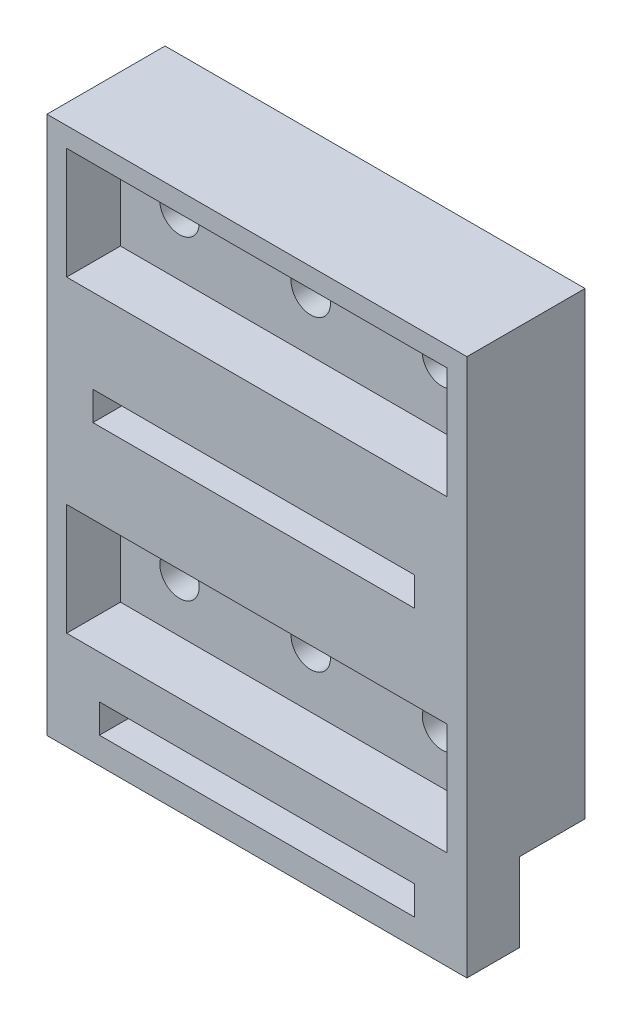
from build123d import *

# Parameters (mm, degrees)
SKETCH4_W                 = 32
SKETCH4_H                 = 35
BOSS_EXTRUDE1_DEPTH       = 9
SHELL1_T                  = -1.5
SHELL1_THICKNESS_2_FACE_W = 29
SHELL1_THICKNESS_2_FACE_H = 32
SHELL1_THICKNESS_2_DEPTH  = 3.4
SKETCH5_R                 = 1.5
CUT_EXTRUDE2_DEPTH        = 9
RIB6_REACH                = 27.362
SKETCH12_WALLS_W          = 81.724747412
SKETCH12_WALLS_H          = 15
SKETCH13_W                = 28
SKETCH13_H                = 10
CUT_EXTRUDE3_DEPTH        = 5
SKETCH15_W                = 24.5
SKETCH15_H                = 2.2
CUT_EXTRUDE4_DEPTH        = 10
SKETCH16_W                = 32
SKETCH16_H                = 4
BOSS_EXTRUDE2_DEPTH       = 6
SKETCH17_W                = 24
SKETCH17_H                = 2.2
CUT_EXTRUDE5_DEPTH        = 10


with BuildPart() as part:
    # Sketch4 → Boss-Extrude1 (new body)
    with BuildSketch(Plane.XY):
        Rectangle(SKETCH4_W, SKETCH4_H)
    extrude(amount=BOSS_EXTRUDE1_DEPTH)

    # Shell1
    shell1_openings = [part.faces().sort_by_distance(p)[0] for p in [
        (0, 0, 9),
    ]]
    offset(amount=SHELL1_T, openings=shell1_openings, kind=Kind.INTERSECTION)

    # Shell1 thickness 2 face (on inner face of the shell) → Shell1 thickness 2 (add)
    with BuildSketch(Plane(origin=(0, 0, 1.5), x_dir=(-1, 0, 0), z_dir=(0, 0, -1))):
        Rectangle(SHELL1_THICKNESS_2_FACE_W, SHELL1_THICKNESS_2_FACE_H)
    extrude(amount=-SHELL1_THICKNESS_2_DEPTH)

    # Sketch5 → Cut-Extrude2 (cut)
    with BuildSketch(Plane.XY.offset(4.9)):
        with Locations((-10, -12)):
            Circle(SKETCH5_R)
        with Locations((10, -12)):
            Circle(SKETCH5_R)
        with Locations((0, 11.7)):
            Circle(SKETCH5_R)
        with Locations((0, -11.7)):
            Circle(SKETCH5_R)
        with Locations((-10, 12)):
            Circle(SKETCH5_R)
        with Locations((10, 12)):
            Circle(SKETCH5_R)
    extrude(amount=-CUT_EXTRUDE2_DEPTH, mode=Mode.SUBTRACT)

    # Sketch12 walls → Rib6 (add, up to next)
    with BuildSketch(Plane.XY.offset(9), mode=Mode.PRIVATE) as rib6_sk1:
        Rectangle(SKETCH12_WALLS_W, SKETCH12_WALLS_H)
    rib6_tool1 = extrude(rib6_sk1.sketch, amount=-RIB6_REACH, mode=Mode.PRIVATE) - part.part
    add(rib6_tool1.solids().sort_by_distance((0, 0, 9))[0])

    # Sketch13 → Cut-Extrude3 (cut)
    with BuildSketch(Plane(origin=(0, 0, 0), x_dir=(-1, 0, 0), z_dir=(0, 0, -1))):
        Rectangle(SKETCH13_W, SKETCH13_H)
    extrude(amount=-CUT_EXTRUDE3_DEPTH, mode=Mode.SUBTRACT)

    # Sketch15 → Cut-Extrude4 (cut)
    with BuildSketch(Plane(origin=(0, 0, 5), x_dir=(-1, 0, 0), z_dir=(0, 0, -1))):
        with Locations((0.25, 0)):
            Rectangle(SKETCH15_W, SKETCH15_H)
    extrude(amount=-CUT_EXTRUDE4_DEPTH, mode=Mode.SUBTRACT)

    # Sketch16 → Boss-Extrude2 (add)
    with BuildSketch(Plane.XZ.offset(17.5)):
        with Locations((0, 7)):
            Rectangle(SKETCH16_W, SKETCH16_H)
    extrude(amount=BOSS_EXTRUDE2_DEPTH)

    # Sketch17 → Cut-Extrude5 (cut)
    with BuildSketch(Plane.XY.offset(9)):
        with Locations((0, -20.38)):
            Rectangle(SKETCH17_W, SKETCH17_H)
    extrude(amount=-CUT_EXTRUDE5_DEPTH, mode=Mode.SUBTRACT)


solid = part.part
